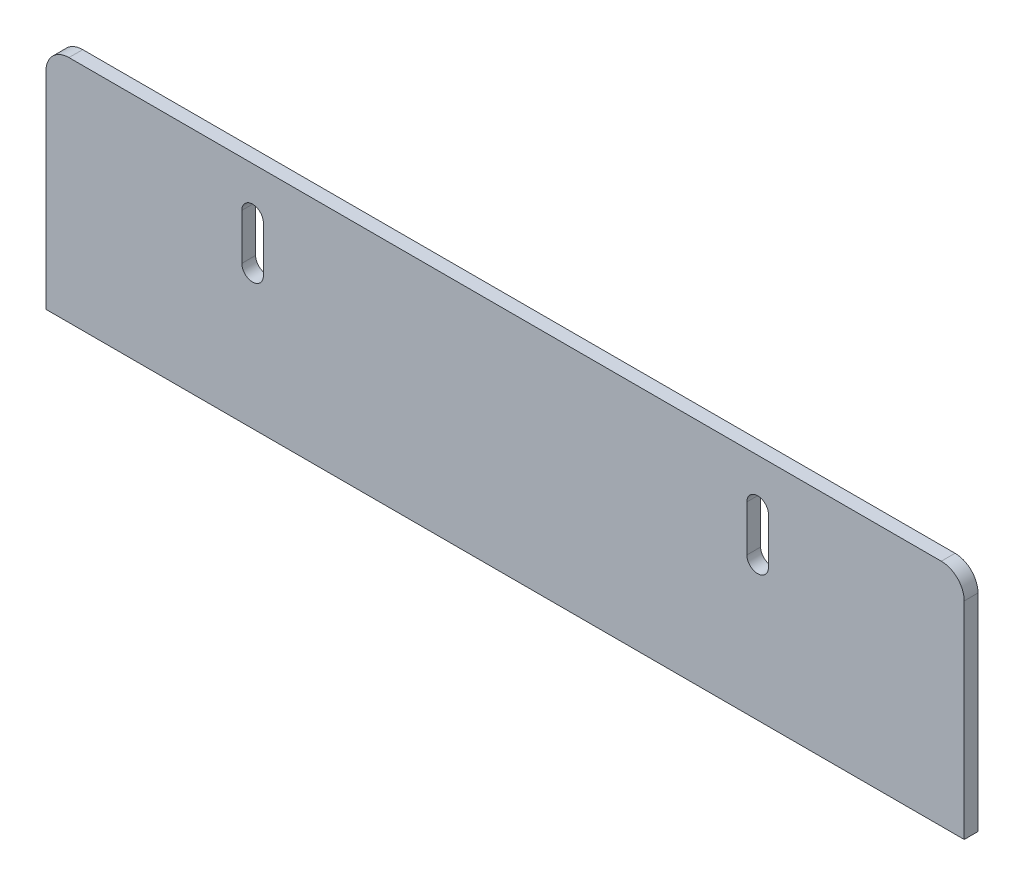
from build123d import *

# Parameters (mm, degrees)
EXTRUDE_1_DEPTH = 3


with BuildPart() as part:
    # 草图1 → 凸台-拉伸1 (new body)
    with BuildSketch(Plane.XY):
        with BuildLine():
            Line((0, 0), (200, 0))
            Line((200, 0), (200, 45))
            ThreePointArc((200, 45), (198.535533906, 48.535533906), (195, 50))
            Line((195, 50), (5, 50))
            ThreePointArc((5, 50), (1.464466094, 48.535533906), (0, 45))
            Line((0, 45), (0, 0))
        make_face()
        with BuildLine():
            Line((42.648985665, 40), (42.648985665, 30))
            ThreePointArc((42.648985665, 30), (45, 27.648985665), (47.351014335, 30))
            Line((47.351014335, 30), (47.351014335, 40))
            ThreePointArc((47.351014335, 40), (45, 42.351014335), (42.648985665, 40))
        make_face(mode=Mode.SUBTRACT)
        with BuildLine():
            Line((152.648985665, 40), (152.648985665, 30))
            ThreePointArc((152.648985665, 30), (155, 27.648985665), (157.351014335, 30))
            Line((157.351014335, 30), (157.351014335, 40))
            ThreePointArc((157.351014335, 40), (155, 42.351014335), (152.648985665, 40))
        make_face(mode=Mode.SUBTRACT)
    extrude(amount=EXTRUDE_1_DEPTH)


solid = part.part
